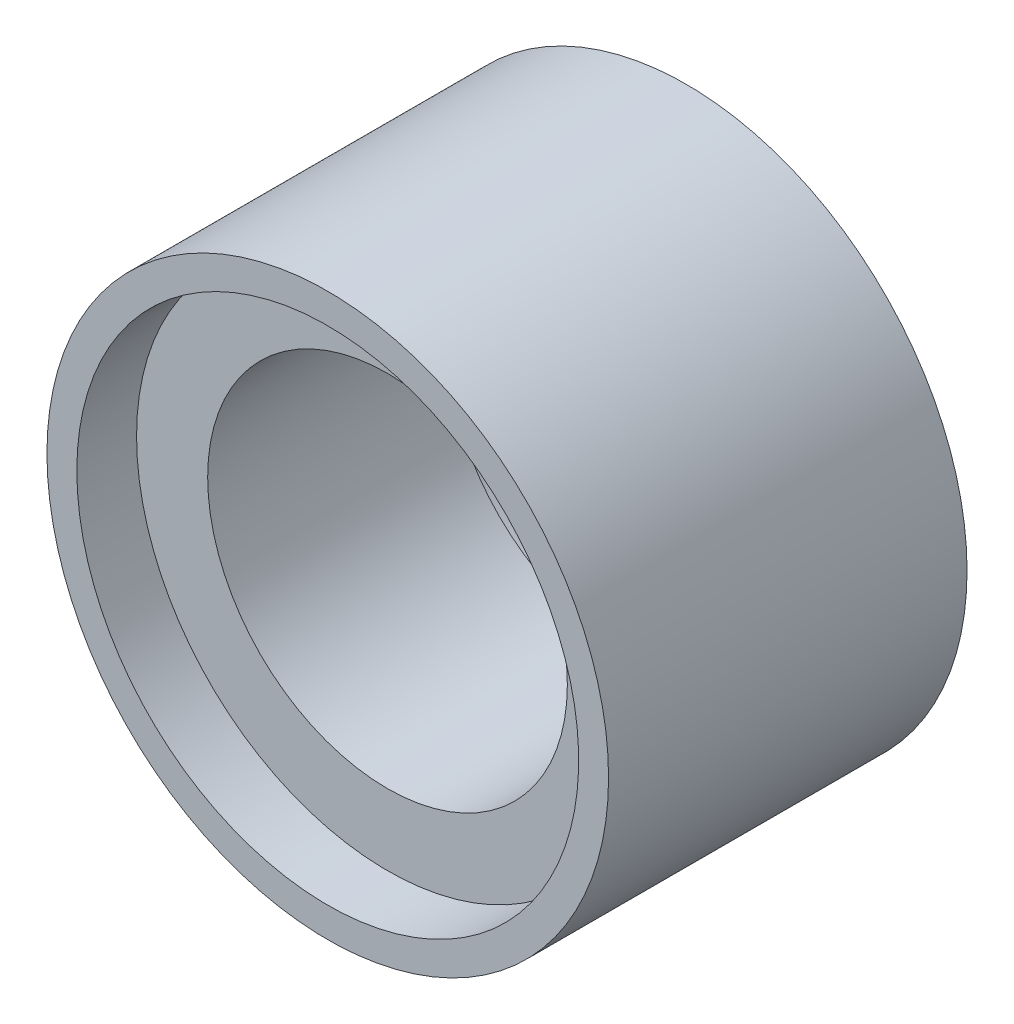
from build123d import *
from build123d.topology import SkipClean

# Parameters (mm, degrees)
SKETCH1_R           = 23.5
SKETCH1_R_2         = 15.05
BOSS_EXTRUDE1_DEPTH = 10
SKETCH2_R           = 23.5
SKETCH2_R_2         = 21
BOSS_EXTRUDE2_DEPTH = 5


with BuildPart() as part:
    # Sketch1 → Boss-Extrude1 (new, symmetric)
    with BuildSketch(Plane.XY):
        Circle(SKETCH1_R)
        Circle(SKETCH1_R_2, mode=Mode.SUBTRACT)
    extrude(amount=BOSS_EXTRUDE1_DEPTH, both=True)

    # Sketch2 → Boss-Extrude2 (add)
    with BuildSketch(Plane(origin=(0, 0, -10), x_dir=(-1, 0, 0), z_dir=(0, 0, -1))):
        Circle(SKETCH2_R)
        Circle(SKETCH2_R_2, mode=Mode.SUBTRACT)
    boss_extrude2 = extrude(amount=BOSS_EXTRUDE2_DEPTH)

    # Mirror1: Boss-Extrude2 across plane
    with SkipClean():  # the faces are left unmerged after this step: merging them gives an invalid solid
        add(boss_extrude2.mirror(Plane.XY))


solid = part.part
